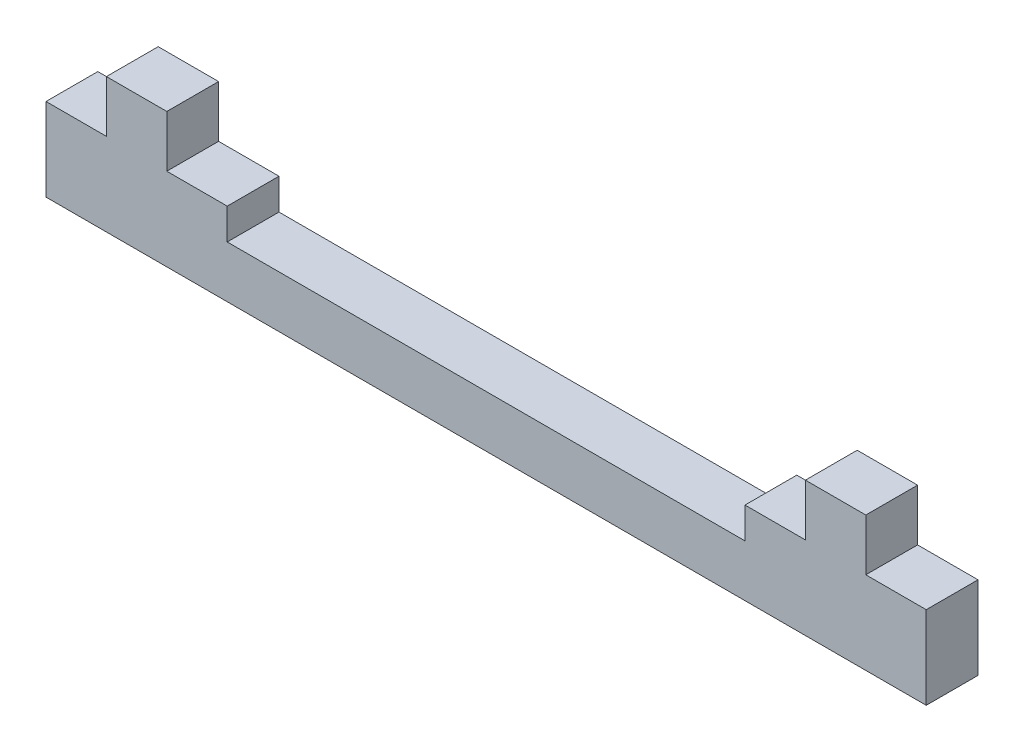
from build123d import *

# Parameters (mm, degrees)
SKETCH1_W           = 85
SKETCH1_H           = 13
BOSS_EXTRUDE1_DEPTH = 5
SKETCH2_W           = 50
SKETCH2_H           = 3
CUT_EXTRUDE1_DEPTH  = 44.283946216
SKETCH3_W           = 5.833333
SKETCH3_H           = 5
SKETCH3_W_2         = 61.666668
CUT_EXTRUDE2_DEPTH  = 44.283946216


with BuildPart() as part:
    # Sketch1 → Boss-Extrude1 (new body)
    with BuildSketch(Plane.XY):
        Rectangle(SKETCH1_W, SKETCH1_H)
    extrude(amount=BOSS_EXTRUDE1_DEPTH)

    # Sketch2 → Cut-Extrude1 (cut, through all)
    with BuildSketch(Plane.XY.offset(5)):
        Rectangle(SKETCH2_W, SKETCH2_H)
    extrude(amount=-CUT_EXTRUDE1_DEPTH, mode=Mode.SUBTRACT)

    # Sketch3 → Cut-Extrude2 (cut, through all)
    with BuildSketch(Plane(origin=(0, 0, 0), x_dir=(-1, 0, 0), z_dir=(0, 0, -1))):
        with Locations((-39.5833335, 4)):
            Rectangle(SKETCH3_W, SKETCH3_H)
        with Locations((0, 4)):
            Rectangle(SKETCH3_W_2, SKETCH3_H)
        with Locations((39.5833335, 4)):
            Rectangle(SKETCH3_W, SKETCH3_H)
    extrude(amount=-CUT_EXTRUDE2_DEPTH, mode=Mode.SUBTRACT)


solid = part.part
